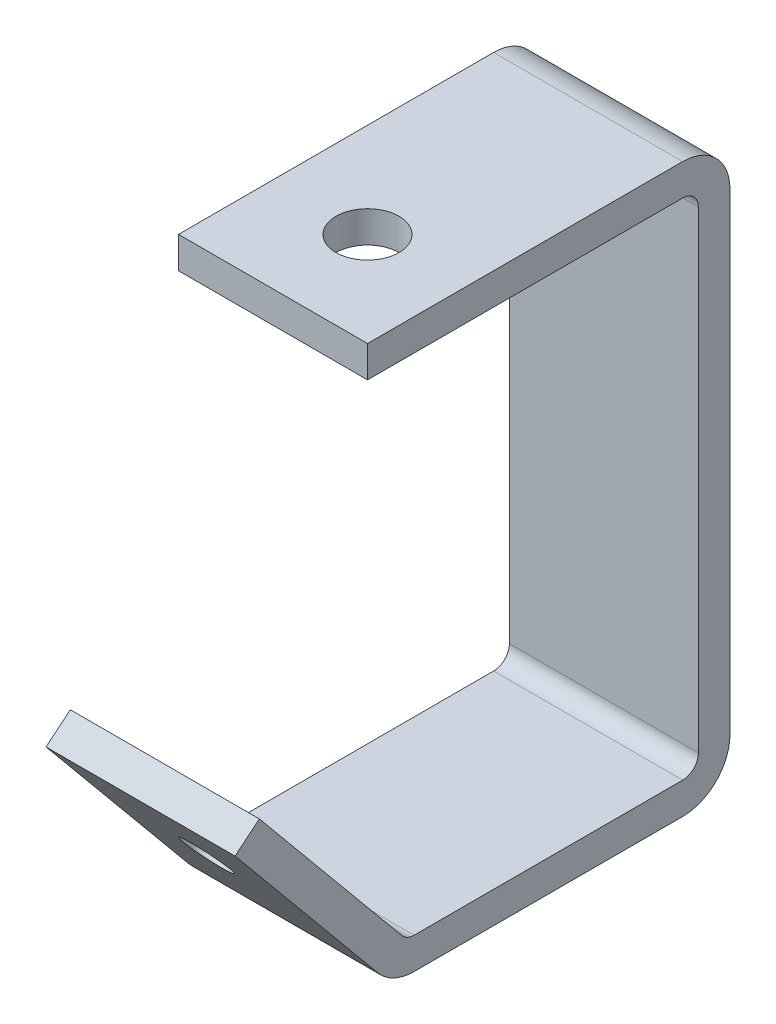
from build123d import *

# Parameters (mm, degrees)
Y_KSEKLIK_EKSTR_ZYON1_DEPTH = 38.1
KES_EKSTR_ZYON1_REACH       = 142.901
IZIM2_R                     = 6.35
KES_EKSTR_ZYON2_REACH       = 151.446
IZIM3_R                     = 4.765


with BuildPart() as part:
    # Çizim1 → Yükseklik-Ekstrüzyon1 (new body)
    with BuildSketch(Plane(origin=(0, 0, 0), x_dir=(0, 0, -1), z_dir=(1, 0, 0))):
        with BuildLine():
            Line((0, 0), (63.51, 0))
            ThreePointArc((63.51, 0), (70.248727625, -2.791272375), (73.04, -9.53))
            Line((73.04, -9.53), (73.04, -104.78))
            ThreePointArc((73.04, -104.78), (70.248727625, -111.518727625), (63.51, -114.31))
            Line((63.51, -114.31), (9.39, -114.31))
            ThreePointArc((9.39, -114.31), (5.332325351, -113.403002751), (2.047011614, -110.854654028))
            Line((2.047011614, -110.854654028), (-26.694452199, -76.112225243))
            Line((-26.694452199, -76.112225243), (-21.801694985, -72.064580639))
            Line((-21.801694985, -72.064580639), (6.939768828, -106.807009424))
            ThreePointArc((6.939768828, -106.807009424), (8.03602252, -107.657350341), (9.39, -107.96))
            Line((9.39, -107.96), (63.51, -107.96))
            ThreePointArc((63.51, -107.96), (65.758599564, -107.028599564), (66.69, -104.78))
            Line((66.69, -104.78), (66.69, -9.53))
            ThreePointArc((66.69, -9.53), (65.758599564, -7.281400436), (63.51, -6.35))
            Line((63.51, -6.35), (0, -6.35))
            Line((0, -6.35), (0, 0))
        make_face()
    extrude(amount=Y_KSEKLIK_EKSTR_ZYON1_DEPTH)

    # Çizim2 → Kes-Ekstrüzyon1 (cut, up to next)
    with BuildSketch(Plane(origin=(0, 0, 0), x_dir=(1, 0, 0), z_dir=(0, 1, 0)), mode=Mode.PRIVATE) as kes_ekstr_zyon1_sk1:
        with Locations(Location((19.05, 19.04, 0), (0, 0, 270))):
            Circle(IZIM2_R)
    kes_ekstr_zyon1_tool1 = extrude(kes_ekstr_zyon1_sk1.sketch, amount=-KES_EKSTR_ZYON1_REACH, mode=Mode.PRIVATE) & part.part
    add(kes_ekstr_zyon1_tool1.solids().sort_by_distance((19.05, 0, -19.04))[0], mode=Mode.SUBTRACT)

    # Çizim3 → Kes-Ekstrüzyon2 (cut, up to next)
    with BuildSketch(Plane(origin=(0, -44.03595524, 53.230275565), x_dir=(1, 0, 0), z_dir=(0, -0.6374243471515584, 0.770512947106283)), mode=Mode.PRIVATE) as kes_ekstr_zyon2_sk1:
        with Locations(Location((19.05, -62.439761218, 0), (0, 0, 270))):
            Circle(IZIM3_R)
    kes_ekstr_zyon2_tool1 = extrude(kes_ekstr_zyon2_sk1.sketch, amount=-KES_EKSTR_ZYON2_REACH, mode=Mode.PRIVATE) & part.part
    add(kes_ekstr_zyon2_tool1.solids().sort_by_distance((19.05, -92.1466, 13.429652))[0], mode=Mode.SUBTRACT)


solid = part.part
